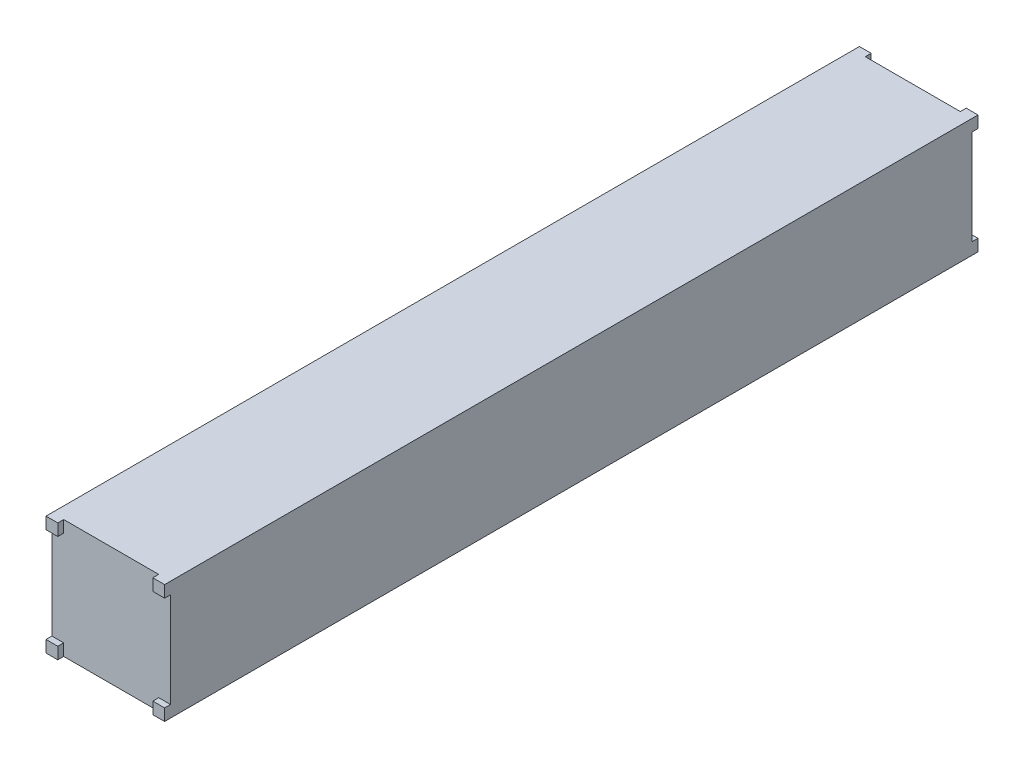
from build123d import *

# Parameters (mm, degrees)
SKETCH1_W           = 100.6
SKETCH1_H           = 100.6
BOSS_EXTRUDE1_DEPTH = 340
SKETCH2_W           = 10
SKETCH2_H           = 10
BOSS_EXTRUDE2_DEPTH = 5
SKETCH3_W           = 10
SKETCH3_H           = 10
BOSS_EXTRUDE3_DEPTH = 5


with BuildPart() as part:
    # Sketch1 → Boss-Extrude1 (new, symmetric)
    with BuildSketch(Plane.XY):
        Rectangle(SKETCH1_W, SKETCH1_H)
    extrude(amount=BOSS_EXTRUDE1_DEPTH, both=True)

    # Sketch2 → Boss-Extrude2 (add)
    with BuildSketch(Plane.XY.offset(340)):
        with Locations((-45.3, 45.3)):
            Rectangle(SKETCH2_W, SKETCH2_H)
        with Locations((45.3, 45.3)):
            Rectangle(SKETCH2_W, SKETCH2_H)
        with Locations((45.3, -45.3)):
            Rectangle(SKETCH2_W, SKETCH2_H)
        with Locations((-45.3, -45.3)):
            Rectangle(SKETCH2_W, SKETCH2_H)
    extrude(amount=BOSS_EXTRUDE2_DEPTH)

    # Sketch3 → Boss-Extrude3 (add)
    with BuildSketch(Plane(origin=(0, 0, -340), x_dir=(-1, 0, 0), z_dir=(0, 0, -1))):
        with Locations((-45.3, 45.3)):
            Rectangle(SKETCH3_W, SKETCH3_H)
        with Locations((45.3, 45.3)):
            Rectangle(SKETCH3_W, SKETCH3_H)
        with Locations((45.3, -45.3)):
            Rectangle(SKETCH3_W, SKETCH3_H)
        with Locations((-45.3, -45.3)):
            Rectangle(SKETCH3_W, SKETCH3_H)
    extrude(amount=BOSS_EXTRUDE3_DEPTH)


solid = part.part
